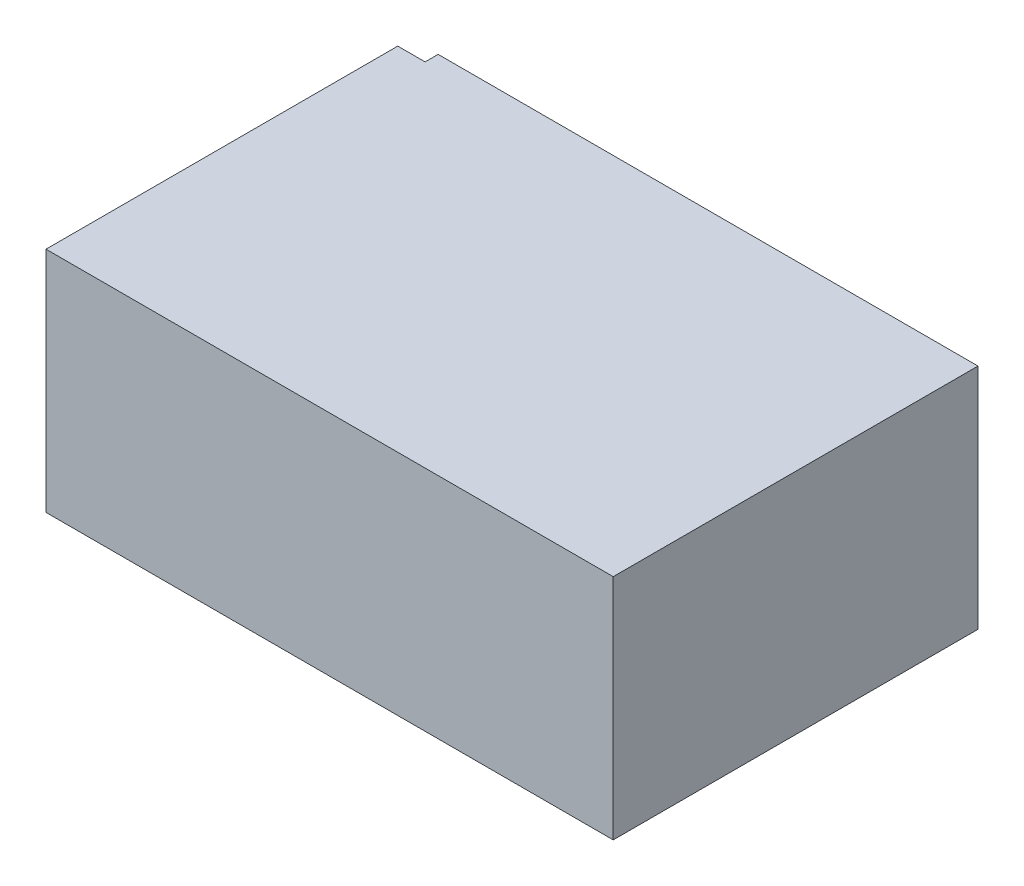
from build123d import *

# Parameters (mm, degrees)
SKETCH_8_W          = 174.15
SKETCH_8_H          = 112
EXTRUDE_3_DEPTH     = 70
SKETCH_10_W         = 8.399681442
SKETCH_10_H         = 17.5
CUT_EXTRUDE_4_DEPTH = 4


with BuildPart() as part:
    # 스케치8 → 보스-돌출3 (new body)
    with BuildSketch(Plane(origin=(0, 0, 0), x_dir=(1, 0, 0), z_dir=(0, 1, 0))):
        Rectangle(SKETCH_8_W, SKETCH_8_H)
    extrude(amount=EXTRUDE_3_DEPTH)

    # 스케치10 → 컷-돌출4 (cut)
    with BuildSketch(Plane(origin=(0, 0, -56), x_dir=(-1, 0, 0), z_dir=(0, 0, -1))):
        with Locations((82.875159279, 61.25)):
            Rectangle(SKETCH_10_W, SKETCH_10_H)
        with Locations((82.875159279, 8.75)):
            Rectangle(SKETCH_10_W, SKETCH_10_H)
    extrude(amount=-CUT_EXTRUDE_4_DEPTH, mode=Mode.SUBTRACT)


solid = part.part
